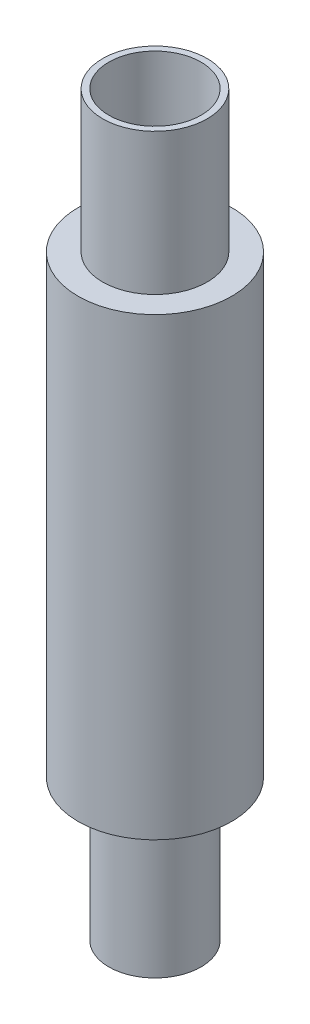
from build123d import *

# Parameters (mm, degrees)
SKETCH1_R           = 7.5
SKETCH1_R_2         = 6.5
BOSS_EXTRUDE1_DEPTH = 23
SKETCH2_R           = 12.5
SKETCH2_R_2         = 6.5
BOSS_EXTRUDE2_DEPTH = 2
SKETCH3_R           = 12.5
SKETCH3_R_2         = 11
BOSS_EXTRUDE3_DEPTH = 70
SKETCH4_R           = 12.5
SKETCH4_R_2         = 7.5
BOSS_EXTRUDE4_DEPTH = 2
SKETCH5_R           = 8.5
SKETCH5_R_2         = 7.5
BOSS_EXTRUDE5_DEPTH = 23


with BuildPart() as part:
    # Sketch1 → Boss-Extrude1 (new body)
    with BuildSketch(Plane(origin=(0, 0, 0), x_dir=(1, 0, 0), z_dir=(0, 1, 0))):
        with Locations(Location((0, 0, 0), (0, 0, 270))):
            Circle(SKETCH1_R)
        with Locations(Location((0, 0, 0), (0, 0, 270))):
            Circle(SKETCH1_R_2, mode=Mode.SUBTRACT)
    extrude(amount=BOSS_EXTRUDE1_DEPTH)

    # Sketch2 → Boss-Extrude2 (add)
    with BuildSketch(Plane(origin=(0, 23, 0), x_dir=(1, 0, 0), z_dir=(0, 1, 0))):
        with Locations(Location((0, 0, 0), (0, 0, 270))):
            Circle(SKETCH2_R)
        with Locations(Location((0, 0, 0), (0, 0, 270))):
            Circle(SKETCH2_R_2, mode=Mode.SUBTRACT)
    extrude(amount=BOSS_EXTRUDE2_DEPTH)

    # Sketch3 → Boss-Extrude3 (add)
    with BuildSketch(Plane(origin=(0, 25, 0), x_dir=(1, 0, 0), z_dir=(0, 1, 0))):
        with Locations(Location((0, 0, 0), (0, 0, 270))):
            Circle(SKETCH3_R)
        with Locations(Location((0, 0, 0), (0, 0, 270))):
            Circle(SKETCH3_R_2, mode=Mode.SUBTRACT)
    extrude(amount=BOSS_EXTRUDE3_DEPTH)

    # Sketch4 → Boss-Extrude4 (add)
    with BuildSketch(Plane(origin=(0, 95, 0), x_dir=(1, 0, 0), z_dir=(0, 1, 0))):
        with Locations(Location((0, 0, 0), (0, 0, 270))):
            Circle(SKETCH4_R)
        with Locations(Location((0, 0, 0), (0, 0, 270))):
            Circle(SKETCH4_R_2, mode=Mode.SUBTRACT)
    extrude(amount=BOSS_EXTRUDE4_DEPTH)

    # Sketch5 → Boss-Extrude5 (add)
    with BuildSketch(Plane(origin=(0, 97, 0), x_dir=(1, 0, 0), z_dir=(0, 1, 0))):
        with Locations(Location((0, 0, 0), (0, 0, 270))):
            Circle(SKETCH5_R)
        with Locations(Location((0, 0, 0), (0, 0, 270))):
            Circle(SKETCH5_R_2, mode=Mode.SUBTRACT)
    extrude(amount=BOSS_EXTRUDE5_DEPTH)


solid = part.part
